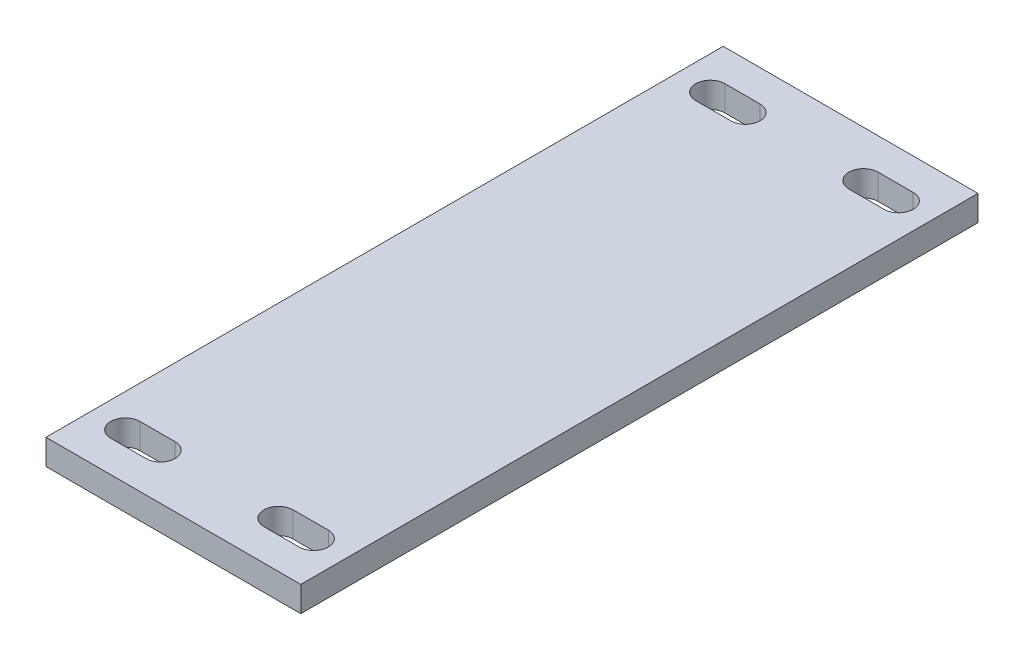
from build123d import *

# Parameters (mm, degrees)
SKETCH1_W           = 60.2
SKETCH1_H           = 160
BOSS_EXTRUDE1_DEPTH = 6


with BuildPart() as part:
    # Sketch1 → Boss-Extrude1 (new body)
    with BuildSketch(Plane(origin=(0, 0, 0), x_dir=(1, 0, 0), z_dir=(0, 1, 0))):
        with Locations((30.1, 80)):
            Rectangle(SKETCH1_W, SKETCH1_H)
        with BuildLine():
            Line((7.85, 152.55), (16.15, 152.55))
            ThreePointArc((16.15, 152.55), (19.6, 149.1), (16.15, 145.65))
            Line((16.15, 145.65), (7.85, 145.65))
            ThreePointArc((7.85, 145.65), (4.4, 149.1), (7.85, 152.55))
        make_face(mode=Mode.SUBTRACT)
        with BuildLine():
            Line((52.35, 145.65), (44.05, 145.65))
            ThreePointArc((44.05, 145.65), (40.6, 149.1), (44.05, 152.55))
            Line((44.05, 152.55), (52.35, 152.55))
            ThreePointArc((52.35, 152.55), (55.8, 149.1), (52.35, 145.65))
        make_face(mode=Mode.SUBTRACT)
        with BuildLine():
            Line((52.35, 7.45), (44.05, 7.45))
            ThreePointArc((44.05, 7.45), (40.6, 10.9), (44.05, 14.35))
            Line((44.05, 14.35), (52.35, 14.35))
            ThreePointArc((52.35, 14.35), (55.8, 10.9), (52.35, 7.45))
        make_face(mode=Mode.SUBTRACT)
        with BuildLine():
            Line((7.85, 14.35), (16.15, 14.35))
            ThreePointArc((16.15, 14.35), (19.6, 10.9), (16.15, 7.45))
            Line((16.15, 7.45), (7.85, 7.45))
            ThreePointArc((7.85, 7.45), (4.4, 10.9), (7.85, 14.35))
        make_face(mode=Mode.SUBTRACT)
    extrude(amount=BOSS_EXTRUDE1_DEPTH)


solid = part.part
